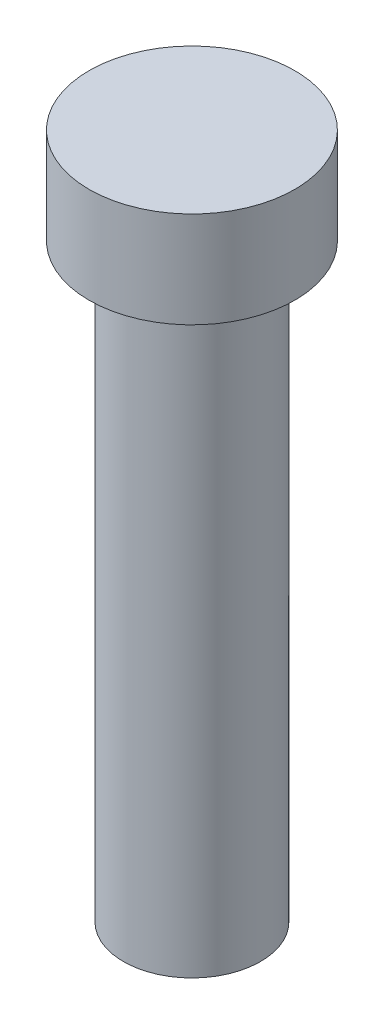
from build123d import *

# Parameters (mm, degrees)
SKETCH1_R           = 7.5
BOSS_EXTRUDE1_DEPTH = 7
SKETCH2_R           = 5
BOSS_EXTRUDE2_DEPTH = 43


with BuildPart() as part:
    # Sketch1 → Boss-Extrude1 (new body)
    with BuildSketch(Plane(origin=(0, 0, 0), x_dir=(-1, 0, 0), z_dir=(0, 1, 0))):
        with Locations(Location((0, 0, 0), (0, 0, 90))):
            Circle(SKETCH1_R)
    extrude(amount=BOSS_EXTRUDE1_DEPTH)

    # Sketch2 → Boss-Extrude2 (add)
    with BuildSketch(Plane.XZ):
        with Locations(Location((0, 0, 0), (0, 0, 270))):
            Circle(SKETCH2_R)
    extrude(amount=BOSS_EXTRUDE2_DEPTH)


solid = part.part
